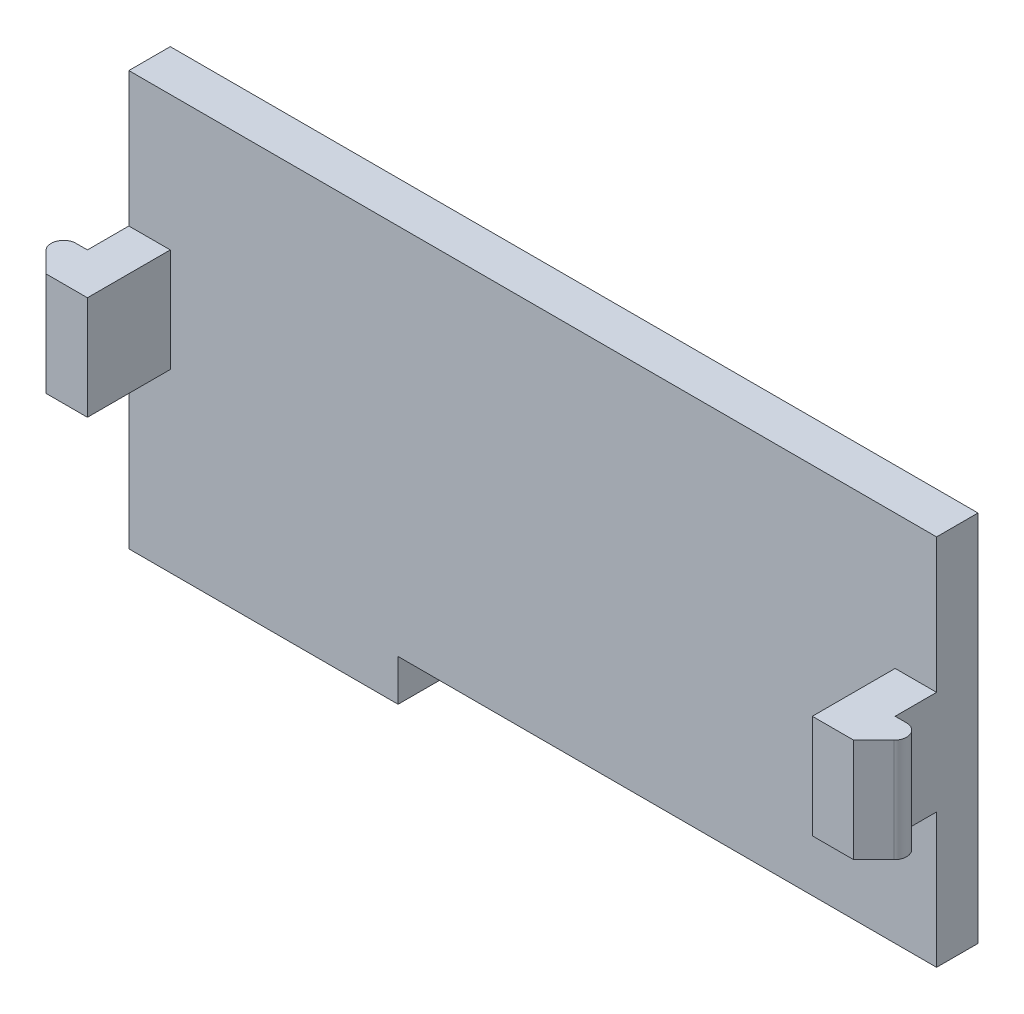
from build123d import *

# Parameters (mm, degrees)
SKETCH1_W           = 40
SKETCH1_H           = 18
BOSS_EXTRUDE1_DEPTH = 2
SKETCH2_W           = 2
SKETCH2_H           = 5
BOSS_EXTRUDE2_DEPTH = 2
BOSS_EXTRUDE3_DEPTH = 5
FILLET1_R           = 0.6
SKETCH4_W           = 13
SKETCH4_H           = 2
BOSS_EXTRUDE4_DEPTH = 2
SKETCH5_W           = 1
SKETCH5_H           = 20
CUT_EXTRUDE1_DEPTH  = 10
SKETCH6_W           = 1
SKETCH6_H           = 2
BOSS_EXTRUDE5_DEPTH = 2


with BuildPart() as part:
    # Sketch1 → Boss-Extrude1 (new body)
    with BuildSketch(Plane.XY):
        with Locations((20, -9)):
            Rectangle(SKETCH1_W, SKETCH1_H)
    extrude(amount=BOSS_EXTRUDE1_DEPTH)

    # Sketch2 → Boss-Extrude2 (add)
    with BuildSketch(Plane.XY.offset(2)):
        with Locations((2, -9)):
            Rectangle(SKETCH2_W, SKETCH2_H)
        with Locations((39, -9)):
            Rectangle(SKETCH2_W, SKETCH2_H)
    extrude(amount=BOSS_EXTRUDE2_DEPTH)

    # Sketch3 → Boss-Extrude3 (add)
    with BuildSketch(Plane.XZ.offset(11.5)):
        Polygon((0, 4), (-1, 4), (1, 6), (3, 6), (3, 4), align=None)
        Polygon((38, 4), (38, 6), (40, 6), (42, 4), (40, 4), align=None)
    extrude(amount=-BOSS_EXTRUDE3_DEPTH)

    # Fillet1
    fillet1_edges = [part.edges().sort_by_distance(p)[0] for p in [
        (-1, -9, 4),
        (42, -9, 4),
    ]]
    fillet(fillet1_edges, radius=FILLET1_R)

    # Sketch4 → Boss-Extrude4 (add)
    with BuildSketch(Plane(origin=(0, 0, 0), x_dir=(-1, 0, 0), z_dir=(0, 0, -1))):
        with Locations((-6.5, -19)):
            Rectangle(SKETCH4_W, SKETCH4_H)
    extrude(amount=-BOSS_EXTRUDE4_DEPTH)

    # Sketch5 → Cut-Extrude1 (cut)
    with BuildSketch(Plane.XY.offset(2)):
        with Locations((0.5, -10)):
            Rectangle(SKETCH5_W, SKETCH5_H)
    extrude(amount=-CUT_EXTRUDE1_DEPTH, mode=Mode.SUBTRACT)

    # Sketch6 → Boss-Extrude5 (add)
    with BuildSketch(Plane.XY.offset(2)):
        with Locations((13.5, -19)):
            Rectangle(SKETCH6_W, SKETCH6_H)
    extrude(amount=-BOSS_EXTRUDE5_DEPTH)


solid = part.part
